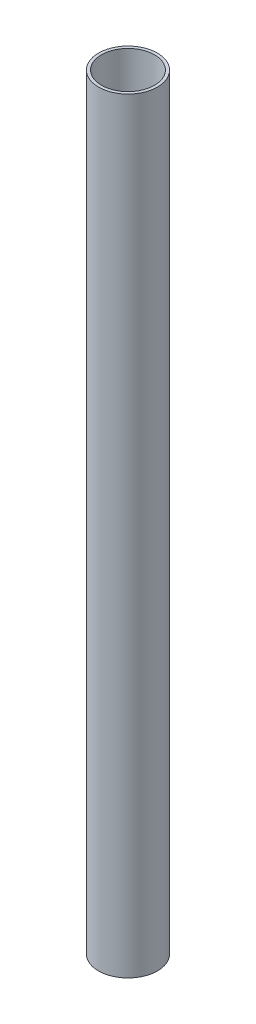
from build123d import *

# Parameters (mm, degrees)
SKETCH_1_R     = 10
SKETCH_1_R_2   = 9
F_1MM_30_DEPTH = 130


with BuildPart() as part:
    # 草图1 → 1mm*30 (new, symmetric)
    with BuildSketch(Plane(origin=(0, 0, 0), x_dir=(1, 0, 0), z_dir=(0, 1, 0))):
        Circle(SKETCH_1_R)
        Circle(SKETCH_1_R_2, mode=Mode.SUBTRACT)
    extrude(amount=F_1MM_30_DEPTH, both=True)


solid = part.part
